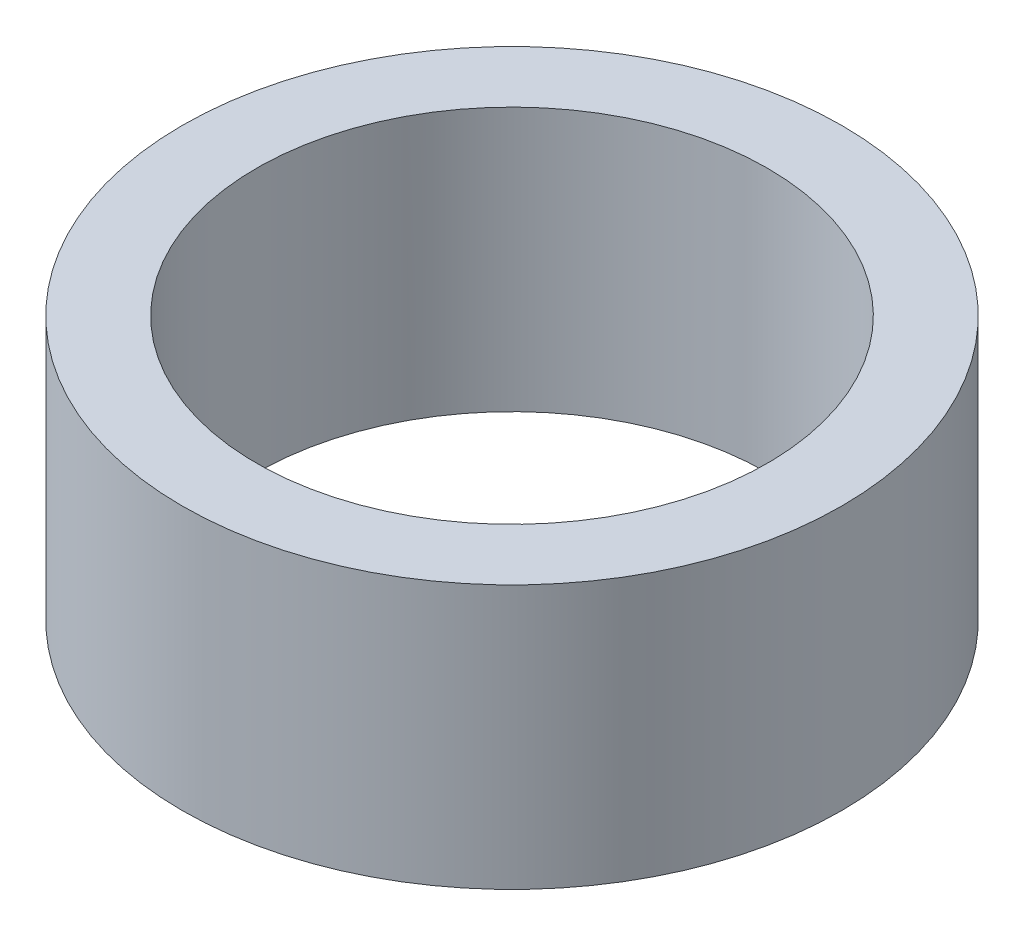
from build123d import *

# Parameters (mm, degrees)
SKETCH1_R           = 10
BOSS_EXTRUDE1_DEPTH = 8


with BuildPart() as part:
    # Sketch1 → Boss-Extrude1 (new body)
    with BuildSketch(Plane(origin=(0, 0, 0), x_dir=(1, 0, 0), z_dir=(0, 1, 0))):
        with Locations(Location((0, 0, 0), (0, 0, 270))):
            Circle(SKETCH1_R)
        with BuildLine():
            ThreePointArc((-7.75, 0), (0, 7.75), (7.75, 0))
            ThreePointArc((7.75, 0), (0, -7.75), (-7.75, 0))
        make_face(mode=Mode.SUBTRACT)
    extrude(amount=BOSS_EXTRUDE1_DEPTH)


solid = part.part
